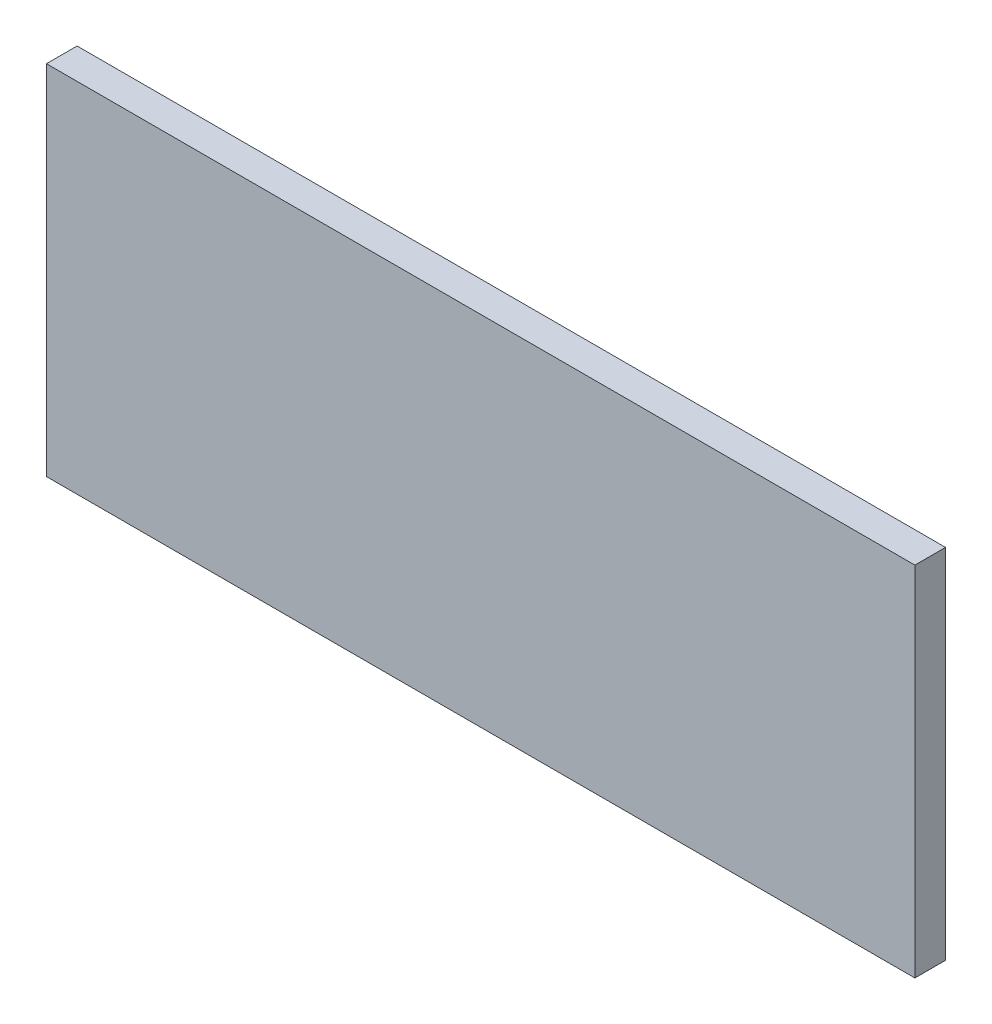
from build123d import *

# Parameters (mm, degrees)
SKETCH1_W           = 510
SKETCH1_H           = 210
BOSS_EXTRUDE1_DEPTH = 18


with BuildPart() as part:
    # Sketch1 → Boss-Extrude1 (new body)
    with BuildSketch(Plane.XY):
        with Locations((250, 100)):
            Rectangle(SKETCH1_W, SKETCH1_H)
    extrude(amount=-BOSS_EXTRUDE1_DEPTH)


solid = part.part
